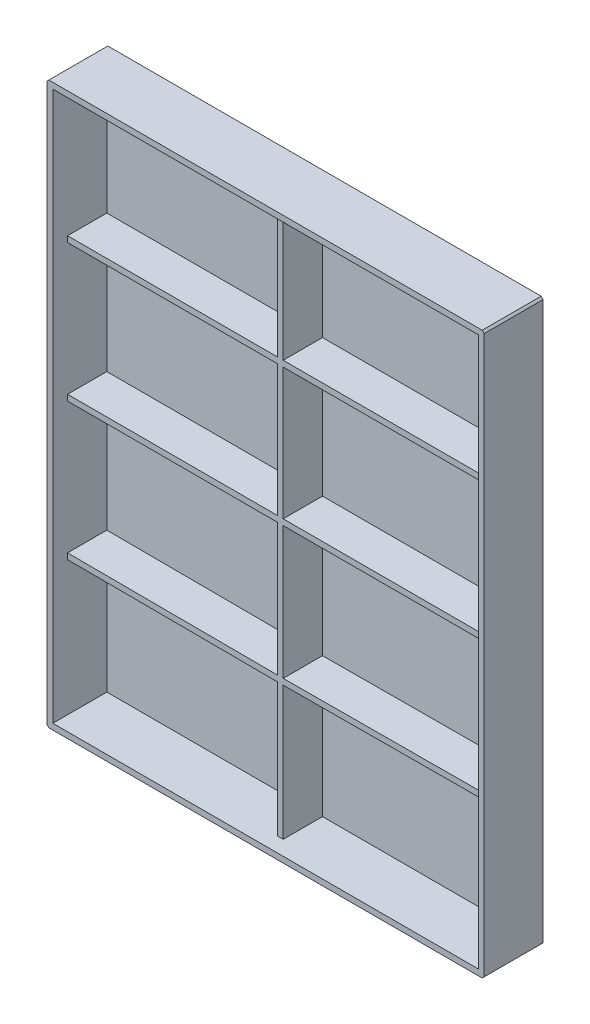
from build123d import *

# Parameters (mm, degrees)
SKETCH1_W                     = 279.6
SKETCH1_H                     = 216.6
BOSS_EXTRUDE1_DEPTH           = 2.5
SKETCH2_W                     = 222.6
SKETCH2_H                     = 285.6
SKETCH2_W_2                   = 216.6
SKETCH2_H_2                   = 279.6
BOSS_EXTRUDE2_WALL_30MM_DEPTH = 30
BOSS_EXTRUDE3_DEPTH           = 20
CHAMFER1_SIZE                 = 1


with BuildPart() as part:
    # Sketch1 → Boss-Extrude1 (new body)
    with BuildSketch(Plane(origin=(0, 0, 0), x_dir=(0, 1, 0), z_dir=(0, 0, 1))):
        Rectangle(SKETCH1_W, SKETCH1_H)
    extrude(amount=BOSS_EXTRUDE1_DEPTH)

    # Sketch2 → Boss-Extrude2 wall 30mm (add)
    with BuildSketch(Plane(origin=(0, 0, 0), x_dir=(1, 0, 0), z_dir=(0, 0, -1))):
        Rectangle(SKETCH2_W, SKETCH2_H)
        Rectangle(SKETCH2_W_2, SKETCH2_H_2, mode=Mode.SUBTRACT)
    extrude(amount=-BOSS_EXTRUDE2_WALL_30MM_DEPTH)

    # Sketch3 → Boss-Extrude3 (add)
    with BuildSketch(Plane.XY.offset(2.5)):
        Polygon((1.5, 71.4), (108.3, 71.4), (108.3, 68.4), (1.5, 68.4), (1.5, 1.5), (108.3, 1.5), (108.3, -1.5), (1.5, -1.5), (1.5, -68.85), (108.3, -68.4), (108.3, -71.4), (1.5, -71.85), (1.5, -139.8), (-1.5, -139.8), (-1.5, -71.85), (-108.3, -71.4), (-108.3, -68.4), (-1.5, -68.85), (-1.5, -1.5), (-108.3, -1.5), (-108.3, 1.5), (-1.5, 1.5), (-1.5, 68.4), (-108.3, 68.4), (-108.3, 71.4), (-1.5, 71.4), (-1.5, 139.8), (1.5, 139.8), align=None)
    extrude(amount=BOSS_EXTRUDE3_DEPTH)

    # Chamfer1
    chamfer1_edges = [part.edges().sort_by_distance(p)[0] for p in [
        (-111.3, -142.8, 15),
        (111.3, -142.8, 15),
        (111.3, 142.8, 15),
        (-111.3, 142.8, 15),
    ]]
    chamfer(chamfer1_edges, length=CHAMFER1_SIZE)


solid = part.part
